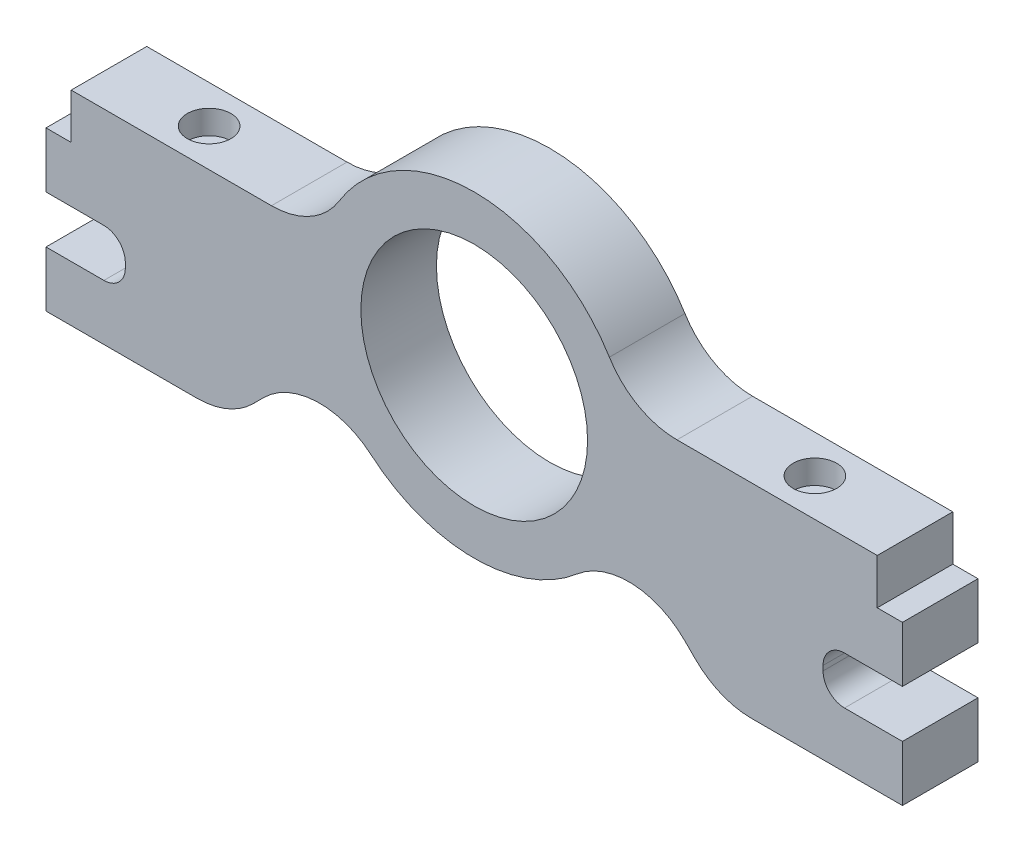
from build123d import *

# Parameters (mm, degrees)
SKETCH1_R           = 14.2875
BOSS_EXTRUDE1_DEPTH = 9.525
SKETCH2_W           = 9.525
SKETCH2_H           = 20
BOSS_EXTRUDE3_DEPTH = 3.175
FILLET1_R           = 10
FILLET2_R           = 10
SKETCH3_R           = 2.75
SKETCH3_R_2         = 1.5
CUT_EXTRUDE1_DEPTH  = 3
SKETCH3_4_R         = 1.5
CUT_EXTRUDE2_DEPTH  = 61.54055588
SKETCH4_W           = 9.525
SKETCH4_H           = 6
CUT_EXTRUDE3_DEPTH  = 10
FILLET3_R           = 2.7


with BuildPart() as part:
    # Sketch1 → Boss-Extrude1 (new body)
    with BuildSketch(Plane.XY):
        with BuildLine():
            Line((50.8, -20), (50.8, 5.7125))
            Line((50.8, 5.7125), (19.166829257, 5.7125))
            ThreePointArc((19.166829257, 5.7125), (0, 20), (-19.166829257, 5.7125))
            Line((-19.166829257, 5.7125), (-50.8, 5.7125))
            Line((-50.8, 5.7125), (-50.8, -20))
            Line((-50.8, -20), (-30.8, -20))
            Line((-30.8, -20), (-18.485895637, -7.633587786))
            ThreePointArc((-18.485895637, -7.633587786), (0, -20), (18.485895637, -7.633587786))
            Line((18.485895637, -7.633587786), (30.8, -20))
            Line((30.8, -20), (50.8, -20))
        make_face()
        Circle(SKETCH1_R, mode=Mode.SUBTRACT)
    extrude(amount=BOSS_EXTRUDE1_DEPTH)

    # Sketch2 → Boss-Extrude3 (add)
    with BuildSketch(Plane(origin=(50.8, 0, 0), x_dir=(0, 0, -1), z_dir=(1, 0, 0))):
        with Locations((-4.7625, -10)):
            Rectangle(SKETCH2_W, SKETCH2_H)
    boss_extrude3 = extrude(amount=BOSS_EXTRUDE3_DEPTH)

    # Mirror1: Boss-Extrude3 across plane
    add(boss_extrude3.mirror(Plane(origin=(0, 0, 0), x_dir=(0, 0, 1), z_dir=(1, 0, 0))))

    # Fillet1
    fillet1_edges = [part.edges().sort_by_distance(p)[0] for p in [
        (-19.166829257, 5.7125, 4.7625),
        (19.166829257, 5.7125, 4.7625),
        (18.485895637, -7.633587786, 4.7625),
        (-18.485895637, -7.633587786, 4.7625),
    ]]
    fillet(fillet1_edges, radius=FILLET1_R)

    # Fillet2
    fillet2_edges = [part.edges().sort_by_distance(p)[0] for p in [
        (-30.8, -20, 4.7625),
        (30.8, -20, 4.7625),
    ]]
    fillet(fillet2_edges, radius=FILLET2_R)

    # Sketch3 → Cut-Extrude1 (cut)
    with BuildSketch(Plane(origin=(0, 5.7125, 0), x_dir=(1, 0, 0), z_dir=(0, 1, 0))):
        with Locations((-38.178080292, -4.7625)):
            Circle(SKETCH3_R)
        with Locations((-38.178080292, -4.7625)):
            Circle(SKETCH3_R_2, mode=Mode.SUBTRACT)
    cut_extrude1 = extrude(amount=-CUT_EXTRUDE1_DEPTH, mode=Mode.SUBTRACT)

    # Sketch3<4> → Cut-Extrude2 (cut, through all)
    with BuildSketch(Plane(origin=(0, 5.7125, 0), x_dir=(1, 0, 0), z_dir=(0, 1, 0))):
        with Locations((-38.178080292, -4.7625)):
            Circle(SKETCH3_4_R)
    cut_extrude2 = extrude(amount=-CUT_EXTRUDE2_DEPTH, mode=Mode.SUBTRACT)

    # Mirror2: Cut-Extrude1, Cut-Extrude2 across plane
    add(cut_extrude1.mirror(Plane(origin=(0, 0, 0), x_dir=(0, 0, 1), z_dir=(1, 0, 0))), mode=Mode.SUBTRACT)
    add(cut_extrude2.mirror(Plane(origin=(0, 0, 0), x_dir=(0, 0, 1), z_dir=(1, 0, 0))), mode=Mode.SUBTRACT)

    # Sketch4 → Cut-Extrude3 (cut)
    with BuildSketch(Plane(origin=(53.975, 0, 0), x_dir=(0, 0, -1), z_dir=(1, 0, 0))):
        with Locations((-4.7625, -10)):
            Rectangle(SKETCH4_W, SKETCH4_H)
    cut_extrude3 = extrude(amount=-CUT_EXTRUDE3_DEPTH, mode=Mode.SUBTRACT)

    # Mirror3: Cut-Extrude3 across plane
    add(cut_extrude3.mirror(Plane(origin=(0, 0, 0), x_dir=(0, 0, 1), z_dir=(1, 0, 0))), mode=Mode.SUBTRACT)

    # Fillet3
    fillet3_edges = [part.edges().sort_by_distance(p)[0] for p in [
        (43.975, -13, 4.7625),
        (43.975, -7, 4.7625),
        (-43.975, -13, 4.7625),
        (-43.975, -7, 4.7625),
    ]]
    fillet(fillet3_edges, radius=FILLET3_R)


solid = part.part
